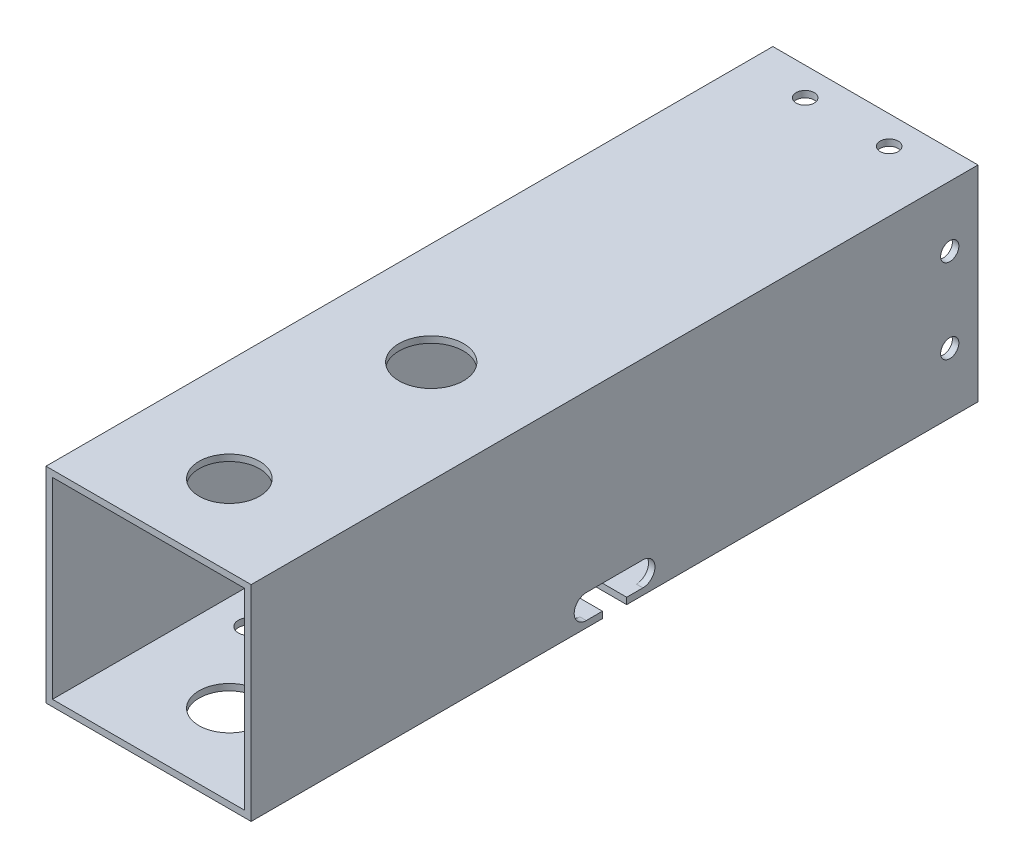
from build123d import *

# Parameters (mm, degrees)
SKETCH1_W                     = 50.8
SKETCH1_H                     = 50.8
SKETCH1_W_2                   = 47.6
SKETCH1_H_2                   = 47.6
BOSS_EXTRUDE1_DEPTH           = 180
SKETCH6_R                     = 7.5
SKETCH6_R_2                   = 8
CUT_EXTRUDE1_DEPTH            = 189.747980122
M4_CLEARANCE_HOLE1_AT_2_COUNT = 2
M4_CLEARANCE_HOLE1_AT_2_PITCH = 20.8
CIRPATTERN1_COUNT             = 4
M5_CLEARANCE_HOLE1_D          = 5.5
M5_CLEARANCE_HOLE1_DEPTH      = 19.75
M5_CLEARANCE_HOLE1_TIP        = 1.652366702
CUT_EXTRUDE2_DEPTH            = 1.6
CUT_EXTRUDE3_DEPTH            = 1.6


with BuildPart() as part:
    # Sketch1 → Boss-Extrude1 (new body)
    with BuildSketch(Plane.XY):
        Rectangle(SKETCH1_W, SKETCH1_H)
        Rectangle(SKETCH1_W_2, SKETCH1_H_2, mode=Mode.SUBTRACT)
    extrude(amount=BOSS_EXTRUDE1_DEPTH)

    # Sketch6 → Cut-Extrude1 (cut, through all)
    with BuildSketch(Plane(origin=(0, 25.4, 0), x_dir=(1, 0, 0), z_dir=(0, 1, 0))):
        with Locations(Location((0, -160, 0), (0, 0, 270))):
            Circle(SKETCH6_R)
        with Locations(Location((0, -110, 0), (0, 0, 270))):
            Circle(SKETCH6_R_2)
    extrude(amount=-CUT_EXTRUDE1_DEPTH, mode=Mode.SUBTRACT)

    # Sketch8 → M4 Clearance Hole1 (revolve, cut)
    with BuildSketch(Plane(origin=(-25.4, -10.4, 7), x_dir=(0, 0, 1), z_dir=(0, 1, 0))):
        Polygon((0, 0), (0, 12.851936393), (2.25, 11.5), (2.25, 0), align=None)
    m4_clearance_hole1 = revolve(axis=Axis((-31.75, -10.4, 7), (1, 0, 0)), mode=Mode.SUBTRACT)

    # M4 Clearance Hole1 at 2: M4 Clearance Hole1 ×2
    with Locations(*[(0, i * M4_CLEARANCE_HOLE1_AT_2_PITCH, 0) for i in range(1, M4_CLEARANCE_HOLE1_AT_2_COUNT)]):
        add(m4_clearance_hole1, mode=Mode.SUBTRACT)

    # CirPattern1: M4 Clearance Hole1 ×4 about axis
    cirpattern1_axis = Axis((0, 0, 0), (0, 0, 1))
    for i in range(1, CIRPATTERN1_COUNT):
        add(m4_clearance_hole1.rotate(cirpattern1_axis, i * 360 / CIRPATTERN1_COUNT), mode=Mode.SUBTRACT)

    # CirPattern1 copy 1 sketch → CirPattern1 copy 1 (revolve, cut)
    with BuildSketch(Plane(origin=(-10.4, -25.4, 7), x_dir=(0, 0, 1), z_dir=(-1, 0, 0))):
        Polygon((0, 0), (0, 12.851936393), (2.25, 11.5), (2.25, 0), align=None)
    revolve(axis=Axis((-10.4, -31.75, 7), (0, 1, 0)), mode=Mode.SUBTRACT)

    # CirPattern1 copy 2 sketch → CirPattern1 copy 2 (revolve, cut)
    with BuildSketch(Plane(origin=(25.4, -10.4, 7), x_dir=(0, 0, 1), z_dir=(0, -1, 0))):
        Polygon((0, 0), (0, 12.851936393), (2.25, 11.5), (2.25, 0), align=None)
    revolve(axis=Axis((31.75, -10.4, 7), (-1, 0, 0)), mode=Mode.SUBTRACT)

    # CirPattern1 copy 3 sketch → CirPattern1 copy 3 (revolve, cut)
    with BuildSketch(Plane(origin=(10.4, 25.4, 7), x_dir=(0, 0, 1), z_dir=(1, 0, 0))):
        Polygon((0, 0), (0, 12.851936393), (2.25, 11.5), (2.25, 0), align=None)
    revolve(axis=Axis((10.4, 31.75, 7), (0, -1, 0)), mode=Mode.SUBTRACT)

    # M5 Clearance Hole1
    with Locations(Plane.XZ.offset(25.4)):
        with Locations((15, 140), (-15, 140), (-15, 45.7), (15, 45.7)):
            Hole(M5_CLEARANCE_HOLE1_D / 2, depth=M5_CLEARANCE_HOLE1_DEPTH)
            with Locations((0, 0, -(M5_CLEARANCE_HOLE1_DEPTH + M5_CLEARANCE_HOLE1_TIP / 2))):  # 118° drill point
                Cone(0, M5_CLEARANCE_HOLE1_D / 2, M5_CLEARANCE_HOLE1_TIP, mode=Mode.SUBTRACT)

    # Sketch13 → Cut-Extrude2 (cut)
    with BuildSketch(Plane(origin=(0, -25.4, 0), x_dir=(-1, 0, 0), z_dir=(0, -1, 0))):
        with BuildLine():
            Line((-13, -93), (-25.4, -93))
            ThreePointArc((-25.4, -93), (-28.4, -90), (-25.4, -87))
            Line((-25.4, -87), (-13, -87))
            ThreePointArc((-13, -87), (-10, -90), (-13, -93))
        make_face()
    extrude(amount=-CUT_EXTRUDE2_DEPTH, mode=Mode.SUBTRACT)

    # Sketch14 → Cut-Extrude3 (cut)
    with BuildSketch(Plane(origin=(25.4, 0, 0), x_dir=(0, 0, -1), z_dir=(1, 0, 0))):
        with BuildLine():
            Line((-97, -17.8), (-83, -17.8))
            ThreePointArc((-83, -17.8), (-80, -20.8), (-83, -23.8))
            Line((-83, -23.8), (-97, -23.8))
            ThreePointArc((-97, -23.8), (-100, -20.8), (-97, -17.8))
        make_face()
    extrude(amount=-CUT_EXTRUDE3_DEPTH, mode=Mode.SUBTRACT)


solid = part.part
